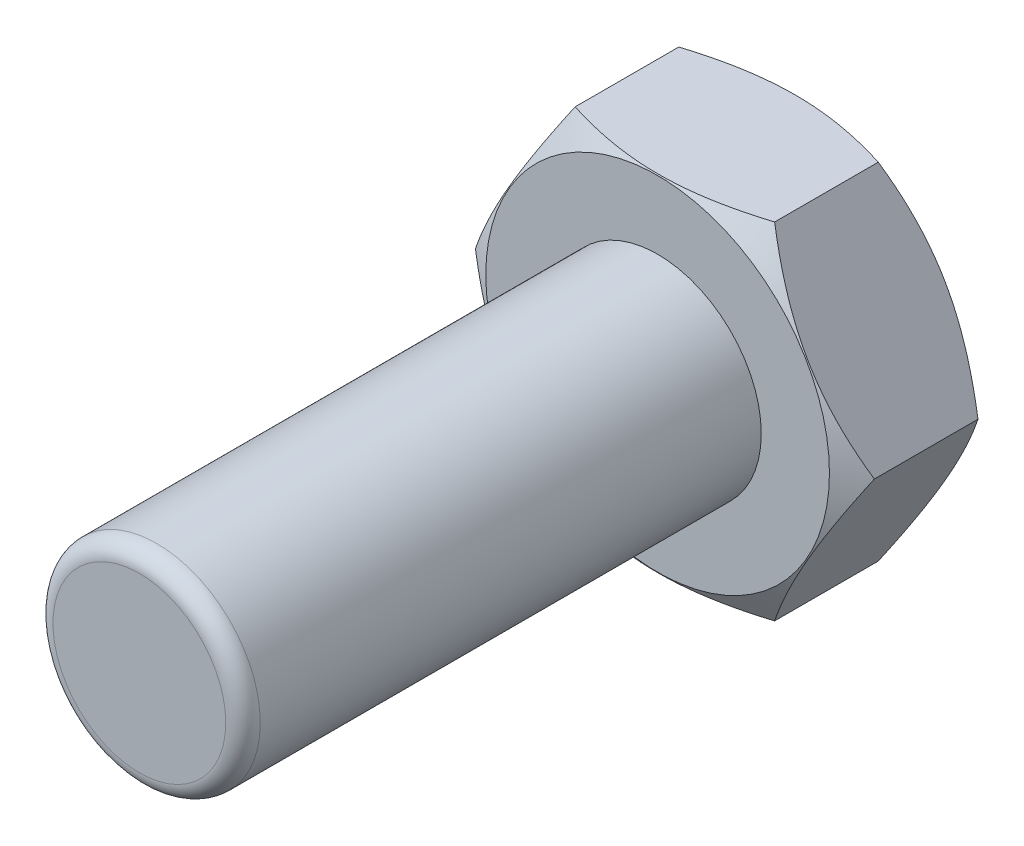
from build123d import *

# Parameters (mm, degrees)
Y_KSEKLIK_EKSTR_ZYON1_DEPTH = 4
IZIM2_R                     = 3
Y_KSEKLIK_EKSTR_ZYON2_DEPTH = 15
RADYUS1_R                   = 0.5


with BuildPart() as part:
    # Çizim1 → Yükseklik-Ekstrüzyon1 (new body)
    with BuildSketch(Plane.XY):
        Polygon((5.773502692, 0), (2.886751346, 5), (-2.886751346, 5), (-5.773502692, 0), (-2.886751346, -5), (2.886751346, -5), align=None)
    extrude(amount=Y_KSEKLIK_EKSTR_ZYON1_DEPTH)

    # Çizim2 → Yükseklik-Ekstrüzyon2 (add)
    with BuildSketch(Plane.XY.offset(4)):
        Circle(IZIM2_R)
    extrude(amount=Y_KSEKLIK_EKSTR_ZYON2_DEPTH)

    # Çizim3 → Kes-Döndür1 (revolve, cut)
    with BuildSketch(Plane(origin=(0, 0, 0), x_dir=(1, 0, 0), z_dir=(0, 1, 0))):
        Polygon((-5.773502692, 0), (-4.973502692, 0), (-5.773502692, -0.5), align=None)
        Polygon((-5.773502692, -4), (-5.773502692, -3.5), (-4.973502692, -4), align=None)
    revolve(axis=Axis((0, 0, 0), (0, 0, 1)), mode=Mode.SUBTRACT)

    # Radyus1
    radyus1_edges = [part.edges().sort_by_distance(p)[0] for p in [
        (-3, 0, 19),
    ]]
    fillet(radyus1_edges, radius=RADYUS1_R)


solid = part.part
